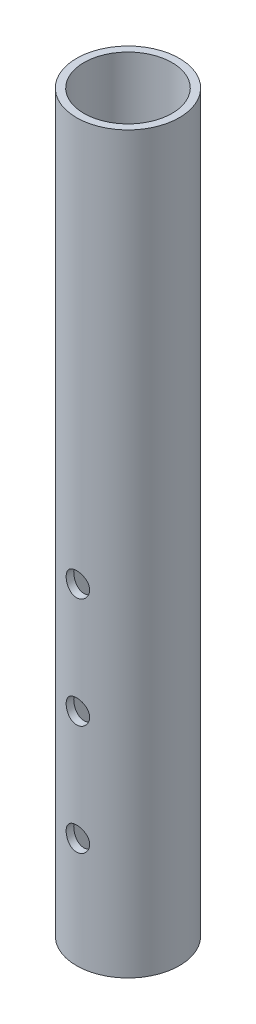
from build123d import *

# Parameters (mm, degrees)
SKETCH_1_R               = 7
SKETCH_1_R_2             = 6
EXTRUDE_1_DEPTH          = 100
CUT_EXTRUDE_1_DEPTH      = 101.488805347
CUT_EXTRUDE_1_DEPTH_BACK = 101.488805347
SKETCH_2_R               = 1.6


with BuildPart() as part:
    # 草图1 → 凸台-拉伸1 (new body)
    with BuildSketch(Plane(origin=(0, 0, 0), x_dir=(1, 0, 0), z_dir=(0, 1, 0))):
        with Locations(Location((0, 0, 0), (0, 0, 270))):
            Circle(SKETCH_1_R)
        with Locations(Location((0, 0, 0), (0, 0, 270))):
            Circle(SKETCH_1_R_2, mode=Mode.SUBTRACT)
    extrude(amount=EXTRUDE_1_DEPTH)

    # 草图2 → 切除-拉伸1 (cut, two sides: drawn at the far end of the back side and taken through both)
    with BuildSketch(Plane.XY.offset(-CUT_EXTRUDE_1_DEPTH_BACK)):
        with Locations((0, 15)):
            Circle(SKETCH_2_R)
        with Locations((0, 30)):
            Circle(SKETCH_2_R)
        with Locations((0, 45)):
            Circle(SKETCH_2_R)
    extrude(amount=CUT_EXTRUDE_1_DEPTH + CUT_EXTRUDE_1_DEPTH_BACK, mode=Mode.SUBTRACT)


solid = part.part
